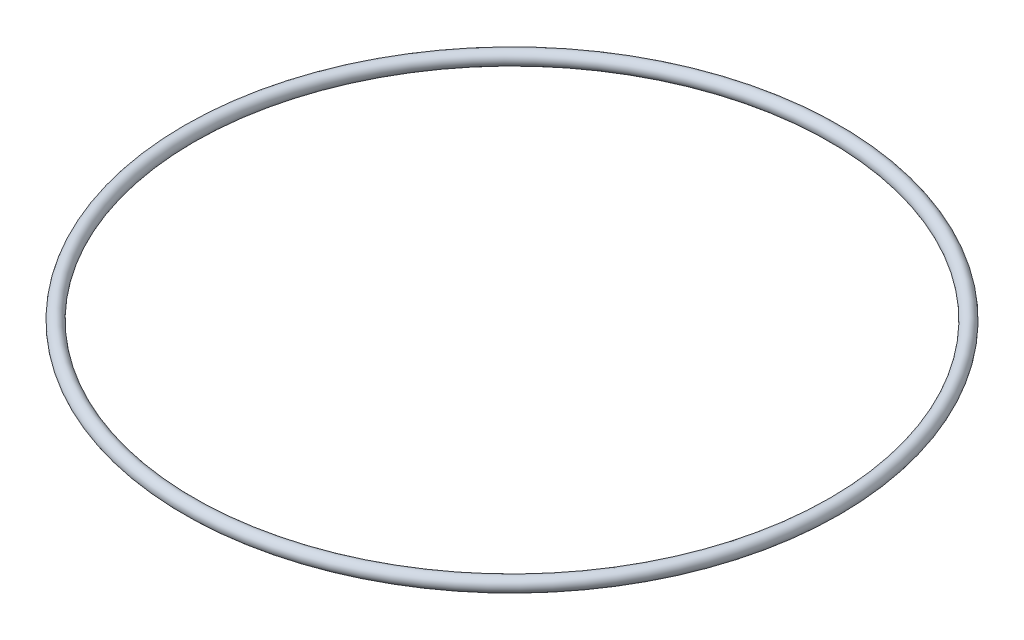
from build123d import *

# Parameters (mm, degrees)
SKETCH5_R = 1.5


with BuildPart() as part:
    # Sweep1: sweep along a path in Sketch3
    with BuildLine(Plane(origin=(0, 0, 0), x_dir=(1, 0, 0), z_dir=(0, 1, 0))) as sweep1_path:
        CenterArc((0, 0), 71.35, 0, 360)
    # Sketch5 → Sweep1 (sweep)
    with BuildSketch(Plane.XY):
        with Locations((71.35, 0)):
            Circle(SKETCH5_R)
    sweep(path=sweep1_path.line)


solid = part.part
